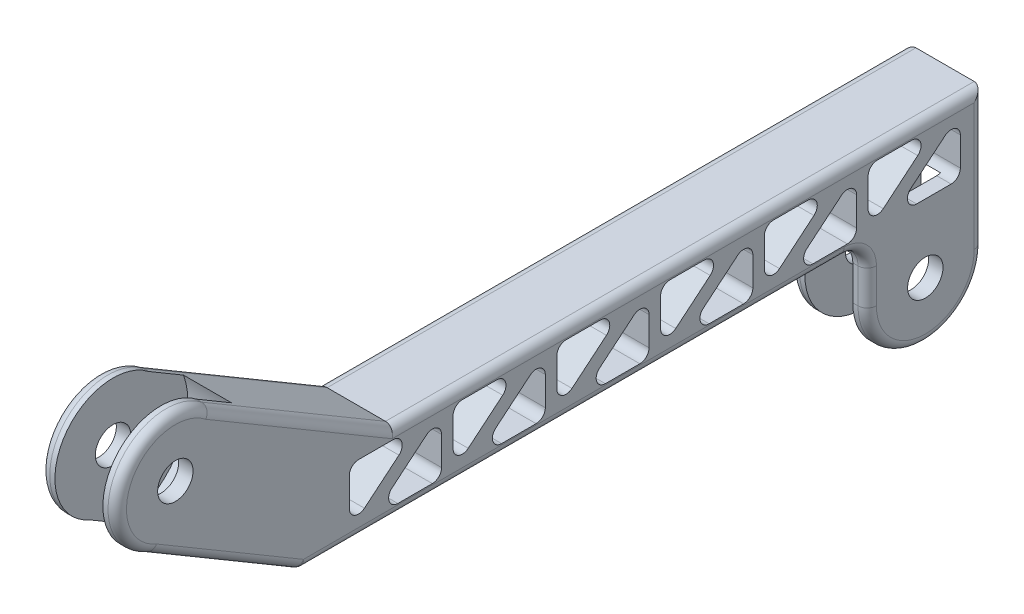
from build123d import *

# Parameters (mm, degrees)
SKETCH2_R               = 2.4384
BOSS_EXTRUDE1_DEPTH     = 10.5664
CUT_EXTRUDE2_DEPTH      = 97.46498413
CUT_EXTRUDE3_DEPTH      = 3.302
CUT_EXTRUDE3_DEPTH_BACK = 3.302
SKETCH4_R               = 10.31875
FILLET10_R              = 1.27


with BuildPart() as part:
    # Sketch2 → Boss-Extrude1 (new body)
    with BuildSketch(Plane(origin=(0, 0, 0), x_dir=(0, 0, -1), z_dir=(1, 0, 0))):
        with BuildLine():
            Line((-1.887455194, -10.8204), (72.898, -10.8204))
            ThreePointArc((72.898, -10.8204), (75.14306403, -11.75033597), (76.073, -13.9954))
            Line((76.073, -13.9954), (76.073, -18.7579))
            ThreePointArc((76.073, -18.7579), (84.074, -26.7589), (92.075, -18.7579))
            Line((92.075, -18.7579), (92.075, 0))
            Line((92.075, 0), (11.009993871, 0))
            Line((11.009993871, 0), (-14.290030059, 14.938561947))
            ThreePointArc((-14.290030059, 14.938561947), (-26.081703159, 12.683140313), (-22.361521098, 1.268643974))
            Line((-22.361521098, 1.268643974), (-1.887455194, -10.8204))
        make_face()
        with Locations((84.074, -18.7579)):
            Circle(SKETCH2_R, mode=Mode.SUBTRACT)
        with Locations((-19.1920645, 8.615108829)):
            Circle(SKETCH2_R, mode=Mode.SUBTRACT)
    extrude(amount=BOSS_EXTRUDE1_DEPTH)

    # Sketch3 → Cut-Extrude2 (cut, through all)
    with BuildSketch(Plane.ZY):
        with BuildLine():
            ThreePointArc((-6.845534188, -7.643088177), (-5.493822647, -7.817545717), (-4.7625, -6.667447152))
            Line((-4.7625, -6.667447152), (-4.7625, -2.71145))
            ThreePointArc((-4.7625, -2.71145), (-5.134474388, -1.813424388), (-6.0325, -1.44145))
            Line((-6.0325, -1.44145), (-10.779696582, -1.44145))
            ThreePointArc((-10.779696582, -1.44145), (-11.973841486, -2.279109915), (-11.59273077, -3.687091025))
            Line((-11.59273077, -3.687091025), (-6.845534188, -7.643088177))
        make_face()
        with BuildLine():
            ThreePointArc((-17.4625, -8.10895), (-17.090525612, -9.006975612), (-16.1925, -9.37895))
            Line((-16.1925, -9.37895), (-11.445303418, -9.37895))
            ThreePointArc((-11.445303418, -9.37895), (-10.251158514, -8.541290085), (-10.63226923, -7.133308975))
            Line((-10.63226923, -7.133308975), (-15.379465812, -3.177311823))
            ThreePointArc((-15.379465812, -3.177311823), (-16.731177353, -3.002854283), (-17.4625, -4.152952848))
            Line((-17.4625, -4.152952848), (-17.4625, -8.10895))
        make_face()
        with BuildLine():
            ThreePointArc((-21.133034188, -7.643088177), (-19.781322647, -7.817545717), (-19.05, -6.667447152))
            Line((-19.05, -6.667447152), (-19.05, -2.71145))
            ThreePointArc((-19.05, -2.71145), (-19.421974388, -1.813424388), (-20.32, -1.44145))
            Line((-20.32, -1.44145), (-25.067196582, -1.44145))
            ThreePointArc((-25.067196582, -1.44145), (-26.261341486, -2.279109915), (-25.88023077, -3.687091025))
            Line((-25.88023077, -3.687091025), (-21.133034188, -7.643088177))
        make_face()
        with BuildLine():
            ThreePointArc((-31.75, -8.10895), (-31.378025612, -9.006975612), (-30.48, -9.37895))
            Line((-30.48, -9.37895), (-25.732803418, -9.37895))
            ThreePointArc((-25.732803418, -9.37895), (-24.538658514, -8.541290085), (-24.91976923, -7.133308975))
            Line((-24.91976923, -7.133308975), (-29.666965812, -3.177311823))
            ThreePointArc((-29.666965812, -3.177311823), (-31.018677353, -3.002854283), (-31.75, -4.152952848))
            Line((-31.75, -4.152952848), (-31.75, -8.10895))
        make_face()
        with BuildLine():
            ThreePointArc((-35.420534188, -7.643088177), (-34.068822647, -7.817545717), (-33.3375, -6.667447152))
            Line((-33.3375, -6.667447152), (-33.3375, -2.71145))
            ThreePointArc((-33.3375, -2.71145), (-33.709474388, -1.813424388), (-34.6075, -1.44145))
            Line((-34.6075, -1.44145), (-39.354696582, -1.44145))
            ThreePointArc((-39.354696582, -1.44145), (-40.548841486, -2.279109915), (-40.16773077, -3.687091025))
            Line((-40.16773077, -3.687091025), (-35.420534188, -7.643088177))
        make_face()
        with BuildLine():
            ThreePointArc((-46.0375, -8.10895), (-45.665525612, -9.006975612), (-44.7675, -9.37895))
            Line((-44.7675, -9.37895), (-40.020303418, -9.37895))
            ThreePointArc((-40.020303418, -9.37895), (-38.826158514, -8.541290085), (-39.20726923, -7.133308975))
            Line((-39.20726923, -7.133308975), (-43.954465812, -3.177311823))
            ThreePointArc((-43.954465812, -3.177311823), (-45.306177353, -3.002854283), (-46.0375, -4.152952848))
            Line((-46.0375, -4.152952848), (-46.0375, -8.10895))
        make_face()
        with BuildLine():
            ThreePointArc((-49.708034188, -7.643088177), (-48.356322647, -7.817545717), (-47.625, -6.667447152))
            Line((-47.625, -6.667447152), (-47.625, -2.71145))
            ThreePointArc((-47.625, -2.71145), (-47.996974388, -1.813424388), (-48.895, -1.44145))
            Line((-48.895, -1.44145), (-53.642196582, -1.44145))
            ThreePointArc((-53.642196582, -1.44145), (-54.836341486, -2.279109915), (-54.45523077, -3.687091025))
            Line((-54.45523077, -3.687091025), (-49.708034188, -7.643088177))
        make_face()
        with BuildLine():
            ThreePointArc((-60.325, -8.10895), (-59.953025612, -9.006975612), (-59.055, -9.37895))
            Line((-59.055, -9.37895), (-54.307803418, -9.37895))
            ThreePointArc((-54.307803418, -9.37895), (-53.113658514, -8.541290085), (-53.49476923, -7.133308975))
            Line((-53.49476923, -7.133308975), (-58.241965812, -3.177311823))
            ThreePointArc((-58.241965812, -3.177311823), (-59.593677353, -3.002854283), (-60.325, -4.152952848))
            Line((-60.325, -4.152952848), (-60.325, -8.10895))
        make_face()
        with BuildLine():
            ThreePointArc((-82.882803418, -9.37895), (-81.688658514, -8.541290085), (-82.06976923, -7.133308975))
            Line((-82.06976923, -7.133308975), (-86.816965812, -3.177311823))
            ThreePointArc((-86.816965812, -3.177311823), (-88.168677353, -3.002854283), (-88.9, -4.152952848))
            Line((-88.9, -4.152952848), (-88.9, -8.10895))
            ThreePointArc((-88.9, -8.10895), (-88.528025612, -9.006975612), (-87.63, -9.37895))
            Line((-87.63, -9.37895), (-82.882803418, -9.37895))
        make_face()
        with BuildLine():
            ThreePointArc((-78.283034188, -7.643088177), (-76.931322647, -7.817545717), (-76.2, -6.667447152))
            Line((-76.2, -6.667447152), (-76.2, -2.71145))
            ThreePointArc((-76.2, -2.71145), (-76.571974388, -1.813424388), (-77.47, -1.44145))
            Line((-77.47, -1.44145), (-82.217196582, -1.44145))
            ThreePointArc((-82.217196582, -1.44145), (-83.411341486, -2.279109915), (-83.03023077, -3.687091025))
            Line((-83.03023077, -3.687091025), (-78.283034188, -7.643088177))
        make_face()
        with BuildLine():
            ThreePointArc((-74.6125, -8.10895), (-74.240525612, -9.006975612), (-73.3425, -9.37895))
            Line((-73.3425, -9.37895), (-68.595303418, -9.37895))
            ThreePointArc((-68.595303418, -9.37895), (-67.401158514, -8.541290085), (-67.78226923, -7.133308975))
            Line((-67.78226923, -7.133308975), (-72.529465812, -3.177311823))
            ThreePointArc((-72.529465812, -3.177311823), (-73.881177353, -3.002854283), (-74.6125, -4.152952848))
            Line((-74.6125, -4.152952848), (-74.6125, -8.10895))
        make_face()
        with BuildLine():
            ThreePointArc((-63.995534188, -7.643088177), (-62.643822647, -7.817545717), (-61.9125, -6.667447152))
            Line((-61.9125, -6.667447152), (-61.9125, -2.71145))
            ThreePointArc((-61.9125, -2.71145), (-62.284474388, -1.813424388), (-63.1825, -1.44145))
            Line((-63.1825, -1.44145), (-67.929696582, -1.44145))
            ThreePointArc((-67.929696582, -1.44145), (-69.123841486, -2.279109915), (-68.74273077, -3.687091025))
            Line((-68.74273077, -3.687091025), (-63.995534188, -7.643088177))
        make_face()
    extrude(amount=-CUT_EXTRUDE2_DEPTH, mode=Mode.SUBTRACT)

    # Sketch4 → Cut-Extrude3 (cut, two sides: drawn at the far end of the back side and taken through both)
    with BuildSketch(Plane(origin=(5.2832, 0, 0), x_dir=(0, 0, -1), z_dir=(1, 0, 0)).offset(-CUT_EXTRUDE3_DEPTH_BACK)):
        with Locations((-19.1920645, 8.615108829)):
            Circle(SKETCH4_R)
        with Locations((84.074, -18.7579)):
            Circle(SKETCH4_R)
    extrude(amount=CUT_EXTRUDE3_DEPTH + CUT_EXTRUDE3_DEPTH_BACK, mode=Mode.SUBTRACT)

    # Fillet10
    fillet10_edges = [part.edges().sort_by_distance(p)[0] for p in [
        (10.5664, -26.7589, -84.074),
        (0, -11.75033597, -75.14306403),
        (0, -10.8204, -35.505272403),
        (0, -4.775878013, 12.124488146),
        (0, 7.469280973, 1.640018094),
        (0, 0, -51.542496936),
        (10.5664, -9.37895, -92.075),
        (0, -9.37895, -92.075),
        (0, -26.7589, -84.074),
        (0, -16.37665, -76.073),
        (5.2832, -10.8204, 1.887455194),
        (10.5664, 0, -51.542496936),
        (10.5664, 7.469280973, 1.640018094),
        (10.5664, -4.775878013, 12.124488146),
        (10.5664, 12.683140313, 26.081703159),
        (0, 12.683140313, 26.081703159),
        (10.5664, -10.8204, -35.505272403),
        (10.5664, -11.75033597, -75.14306403),
        (10.5664, -16.37665, -76.073),
    ]]
    fillet(fillet10_edges, radius=FILLET10_R)


solid = part.part
